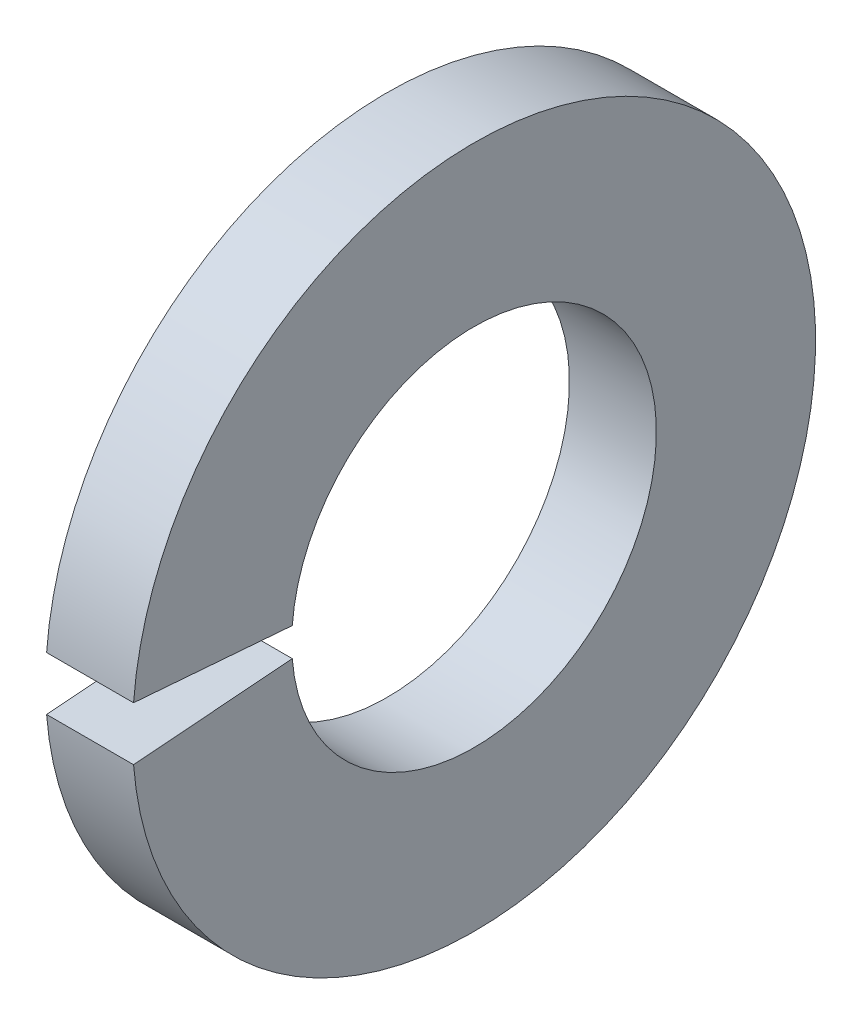
from build123d import *

# Parameters (mm, degrees)
SKETCH1_W      = 1.5748
SKETCH1_H      = 2.8829
REVOLVE1_ANGLE = 351


with BuildPart() as part:
    # Sketch1 → Revolve1 (revolve)
    with BuildSketch(Plane(origin=(0, 0, 0), x_dir=(-1, 0, 0), z_dir=(0, 0.996917333733128, 0.07845909572784564))):
        with Locations((0.7874, 4.74345)):
            Rectangle(SKETCH1_W, SKETCH1_H)
    revolve(axis=Axis((0, 0, 0), (1, 0, 0)), revolution_arc=REVOLVE1_ANGLE)


solid = part.part
